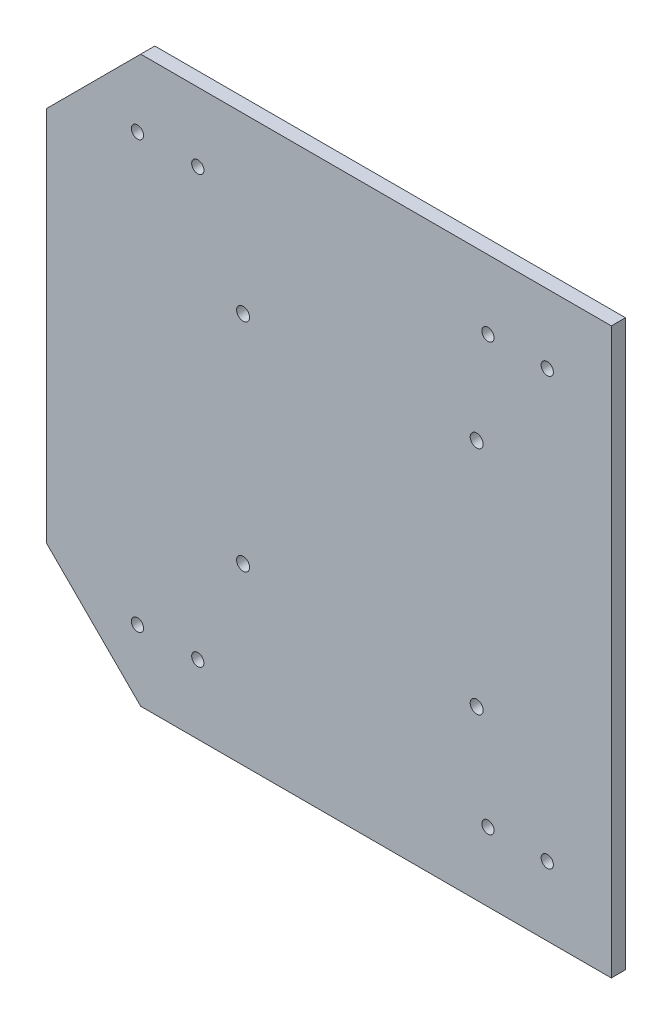
from build123d import *

# Parameters (mm, degrees)
BOSS_EXTRUDE1_DEPTH = 3.81
SKETCH2_R           = 1.65
CUT_EXTRUDE1_DEPTH  = 8.89
SKETCH3_R           = 1.75
CUT_EXTRUDE2_DEPTH  = 154.633260071


with BuildPart() as part:
    # Sketch1 → Boss-Extrude1 (new body)
    with BuildSketch(Plane.XY):
        Polygon((-107.95, -76.2), (-133.35, -50.8), (-133.35, 50.8), (-107.95, 76.2), (19.05, 76.2), (19.05, -76.2), align=None)
    extrude(amount=BOSS_EXTRUDE1_DEPTH)

    # Sketch2 → Cut-Extrude1 (cut)
    with BuildSketch(Plane.XY.offset(3.81)):
        with Locations((1.75833287, 57.577017073)):
            Circle(SKETCH2_R)
        with Locations((-14.239074115, 57.577017073)):
            Circle(SKETCH2_R)
        with Locations((-92.542171462, 57.577017073)):
            Circle(SKETCH2_R)
        with Locations((-108.82023471, 57.577017073)):
            Circle(SKETCH2_R)
        with Locations((-108.82023471, -57.577017073)):
            Circle(SKETCH2_R)
        with Locations((-92.542171462, -57.577017073)):
            Circle(SKETCH2_R)
        with Locations((-14.239074115, -57.577017073)):
            Circle(SKETCH2_R)
        with Locations((1.75833287, -57.577017073)):
            Circle(SKETCH2_R)
    extrude(amount=-CUT_EXTRUDE1_DEPTH, mode=Mode.SUBTRACT)

    # Sketch3 → Cut-Extrude2 (cut, through all)
    with BuildSketch(Plane.XY.offset(3.81)):
        with Locations((-80.308350336, 29.360206552)):
            Circle(SKETCH3_R)
        with Locations((-17.285686927, 31.245112915)):
            Circle(SKETCH3_R)
        with Locations((-17.285686927, -30.956551268)):
            Circle(SKETCH3_R)
        with Locations((-80.308350336, -29.071644905)):
            Circle(SKETCH3_R)
    extrude(amount=-CUT_EXTRUDE2_DEPTH, mode=Mode.SUBTRACT)


solid = part.part
